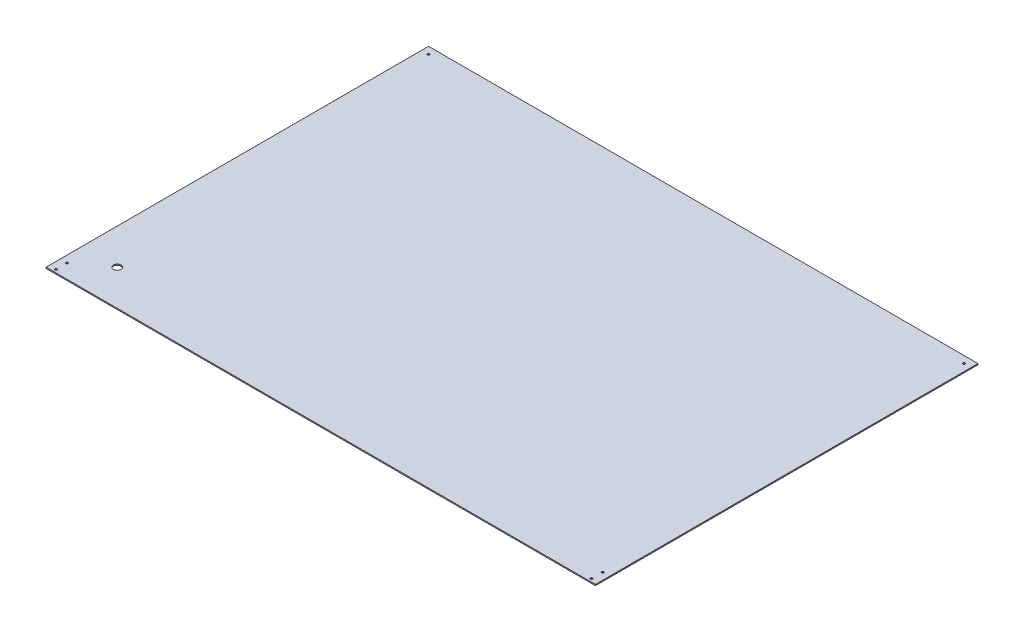
from build123d import *

# Parameters (mm, degrees)
BOSS_EXTRUDE1_DEPTH      = 790
BOSS_EXTRUDE1_DEPTH_BACK = 790
SKETCH3_W                = 1100
SKETCH3_H                = 3.175
SKETCH4_R                = 11
CUT_EXTRUDE1_DEPTH       = 10
SKETCH5_R                = 3.175
CUT_EXTRUDE2_DEPTH       = 10
SKETCH6_R                = 3.175
CUT_EXTRUDE3_DEPTH       = 10


with BuildPart() as part:
    # Sketch3 → Boss-Extrude1 (new, two sides: drawn at the far end of the back side and taken through both)
    with BuildSketch(Plane(origin=(0, 0, 0), x_dir=(0, 0, -1), z_dir=(1, 0, 0)).offset(-BOSS_EXTRUDE1_DEPTH_BACK)):
        Rectangle(SKETCH3_W, SKETCH3_H)
    extrude(amount=BOSS_EXTRUDE1_DEPTH + BOSS_EXTRUDE1_DEPTH_BACK)

    # Sketch4 → Cut-Extrude1 (cut)
    with BuildSketch(Plane(origin=(0, 1.5875, 0), x_dir=(1, 0, 0), z_dir=(0, 1, 0))):
        with Locations(Location((-687.6, -447.6, 0), (0, 0, 270))):
            Circle(SKETCH4_R)
    extrude(amount=-CUT_EXTRUDE1_DEPTH, mode=Mode.SUBTRACT)

    # Sketch5 → Cut-Extrude2 (cut)
    with BuildSketch(Plane(origin=(0, -1.5875, 0), x_dir=(-1, 0, 0), z_dir=(0, -1, 0))):
        with Locations(Location((770, 530, 0), (0, 0, 90))):
            Circle(SKETCH5_R)
        with Locations(Location((-770, 530, 0), (0, 0, 270))):
            Circle(SKETCH5_R)
    extrude(amount=-CUT_EXTRUDE2_DEPTH, mode=Mode.SUBTRACT)

    # Sketch6 → Cut-Extrude3 (cut)
    with BuildSketch(Plane(origin=(0, 1.5875, 0), x_dir=(1, 0, 0), z_dir=(0, 1, 0))):
        with Locations(Location((-770, -509, 0), (0, 0, 270))):
            Circle(SKETCH6_R)
        with Locations(Location((-770, -541, 0), (0, 0, 270))):
            Circle(SKETCH6_R)
        with Locations(Location((770, -541, 0), (0, 0, 270))):
            Circle(SKETCH6_R)
        with Locations(Location((770, -509, 0), (0, 0, 90))):
            Circle(SKETCH6_R)
    extrude(amount=-CUT_EXTRUDE3_DEPTH, mode=Mode.SUBTRACT)


solid = part.part
